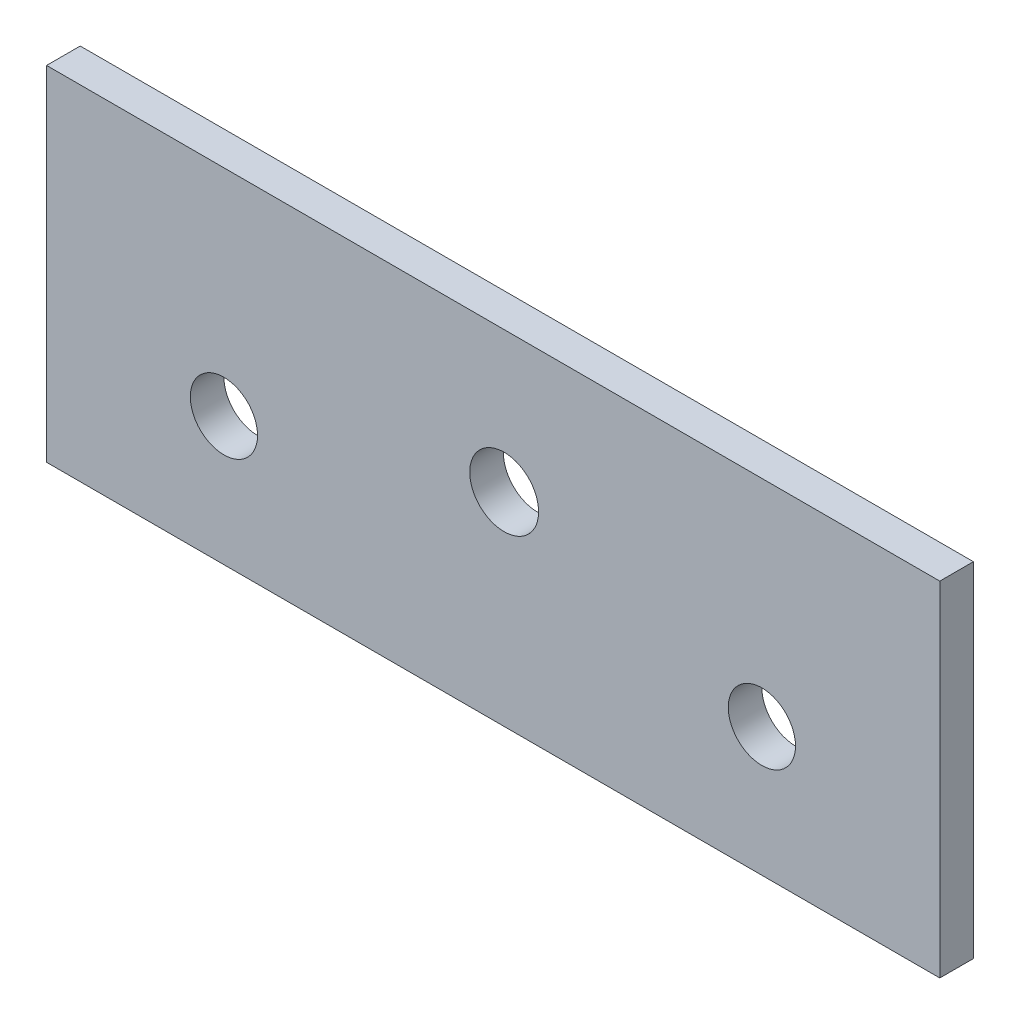
from build123d import *

# Parameters (mm, degrees)
SKETCH1_W           = 84.344029969
SKETCH1_H           = 32.458144774
SKETCH1_R           = 3.175
SKETCH1_R_2         = 3.2512
BOSS_EXTRUDE1_DEPTH = 3.175


with BuildPart() as part:
    # Sketch1 → Boss-Extrude1 (new body)
    with BuildSketch(Plane.XY):
        with Locations((50.827132306, -172.818214402)):
            Rectangle(SKETCH1_W, SKETCH1_H)
        with Locations((25.4, -176.892857143)):
            Circle(SKETCH1_R, mode=Mode.SUBTRACT)
        with Locations((76.2, -176.892857143)):
            Circle(SKETCH1_R, mode=Mode.SUBTRACT)
        with Locations((51.862046607, -169.868155983)):
            Circle(SKETCH1_R_2, mode=Mode.SUBTRACT)
    extrude(amount=BOSS_EXTRUDE1_DEPTH)


solid = part.part
